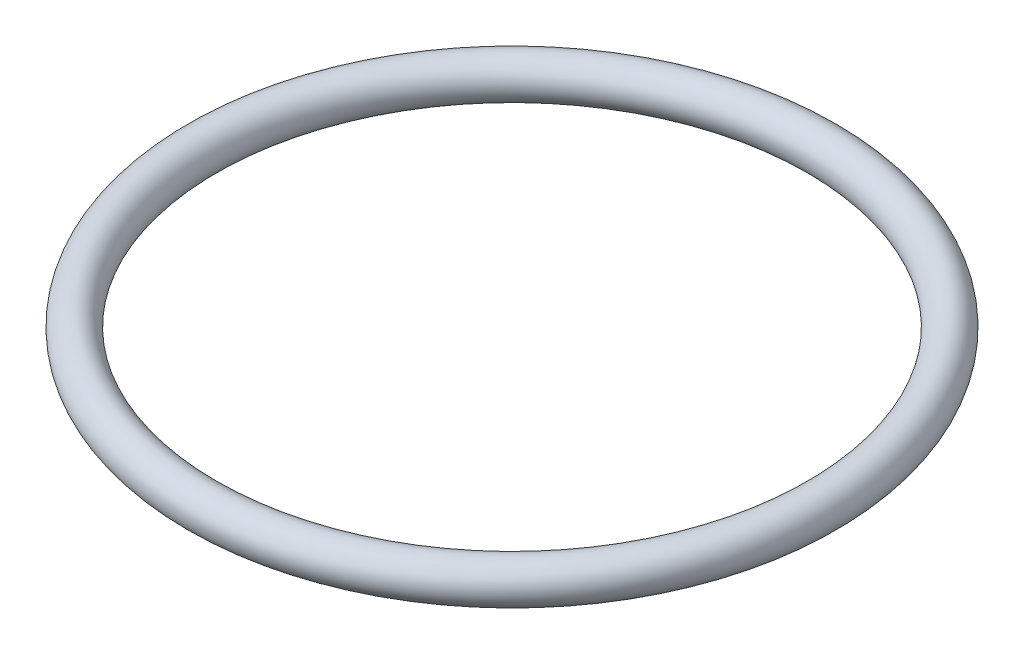
from build123d import *

# Parameters (mm, degrees)
ESQUISSE1_R = 1.45


with BuildPart() as part:
    # Esquisse1 → Révolution1 (revolve)
    with BuildSketch(Plane.XY, mode=Mode.PRIVATE) as r_volution1_sk:
        with Locations((22.42, 0)):
            Circle(ESQUISSE1_R)
    revolve(r_volution1_sk.sketch.rotate(Axis((0, 10.854071722, 0), (0, -1, 0)), 90), axis=Axis((0, 10.854071722, 0), (0, -1, 0)))


solid = part.part
